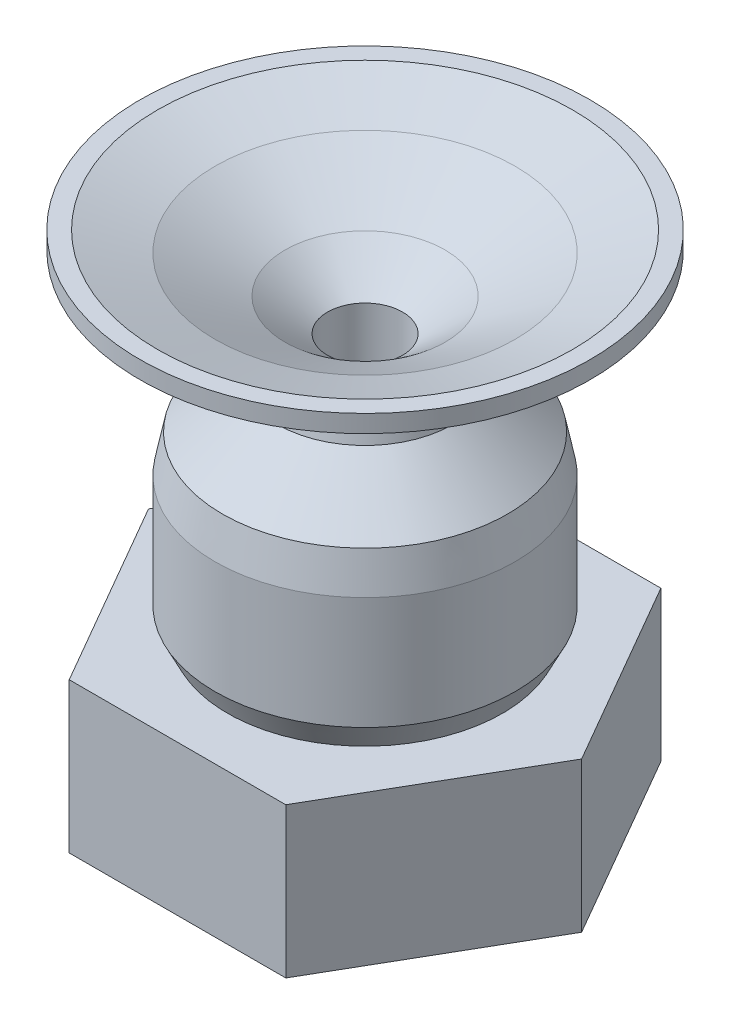
from build123d import *

# Parameters (mm, degrees)
SKETCH_1_R      = 1.5
AF15_H6_3_DEPTH = 6


with BuildPart() as part:
    # 草圖1 → 六角底座_AF15_H6_通氣孔3 (new body)
    with BuildSketch(Plane(origin=(0, 0, 0), x_dir=(1, 0, 0), z_dir=(0, 1, 0))):
        Polygon((8.660254038, 0), (4.330127019, 7.5), (-4.330127019, 7.5), (-8.660254038, 0), (-4.330127019, -7.5), (4.330127019, -7.5), align=None)
        with Locations(Location((0, 0, 0), (0, 0, 270))):
            Circle(SKETCH_1_R, mode=Mode.SUBTRACT)
    extrude(amount=AF15_H6_3_DEPTH)


with BuildPart() as body_2:
    # 草圖2 → 吸盤_口徑18_H14_中空唇口 (revolve)
    with BuildSketch(Plane.XY, mode=Mode.PRIVATE) as revolve_18_h14_sk:
        Polygon((1.5, 6), (5.5, 6), (6, 7), (6, 11.5), (5.7, 13), (3.5, 15), (3.3, 16), (4.2, 17), (6.4, 18.3), (9, 19.3), (9, 20), (8.3, 20), (6, 19.2), (3.2, 17.7), (1.5, 16.4), align=None)
    revolve(revolve_18_h14_sk.sketch.rotate(Axis((0, 0, 0), (0, 1, 0)), 90), axis=Axis((0, 0, 0), (0, 1, 0)))


solid = Compound([part.part, body_2.part])
